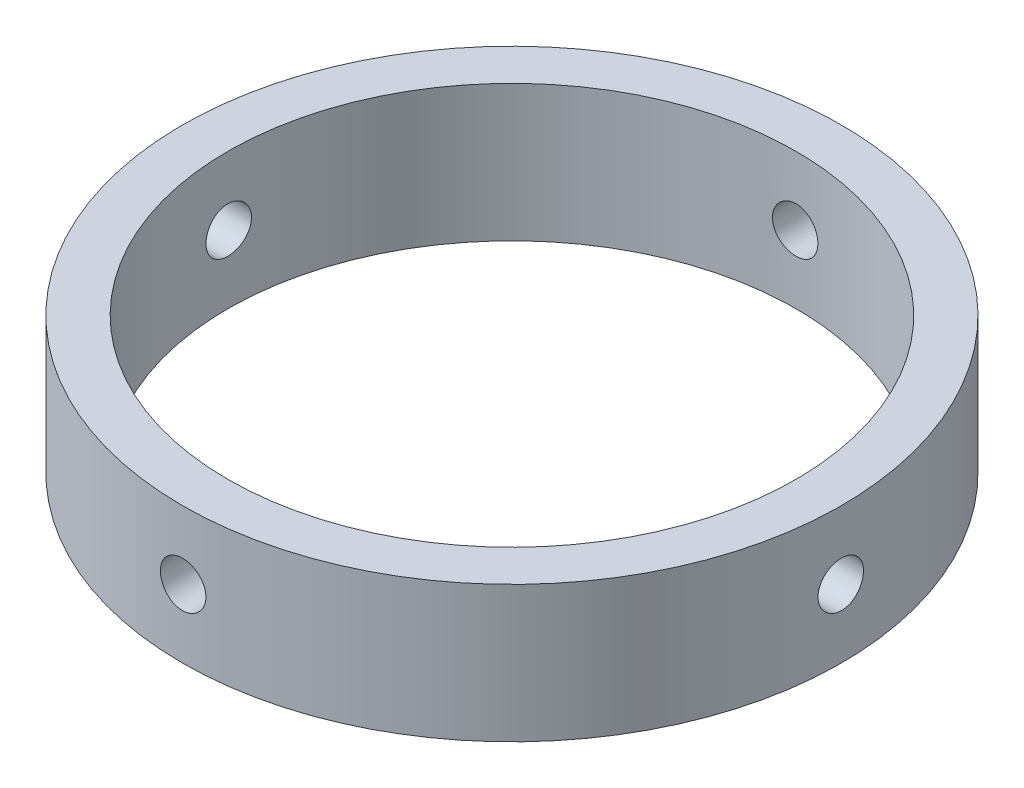
from build123d import *

# Parameters (mm, degrees)
SKETCH1_R               = 46.0375
SKETCH1_R_2             = 39.6875
BOSS_EXTRUDE1_DEPTH     = 19.05
CUT_EXTRUDE4_DEPTH      = 76.2
CUT_EXTRUDE4_DEPTH_BACK = 76.2
SKETCH7_R               = 3.175
CUT_EXTRUDE5_DEPTH      = 76.2
CUT_EXTRUDE5_DEPTH_BACK = 76.2
SKETCH10_R              = 3.175


with BuildPart() as part:
    # Sketch1 → Boss-Extrude1 (new body)
    with BuildSketch(Plane(origin=(0, 0, 0), x_dir=(1, 0, 0), z_dir=(0, 1, 0))):
        Circle(SKETCH1_R)
        Circle(SKETCH1_R_2, mode=Mode.SUBTRACT)
    extrude(amount=BOSS_EXTRUDE1_DEPTH)

    # Sketch7 → Cut-Extrude4 (cut, two sides: drawn at the far end of the back side and taken through both)
    with BuildSketch(Plane.XY.offset(-CUT_EXTRUDE4_DEPTH_BACK)):
        with Locations((0, 9.525)):
            Circle(SKETCH7_R)
    extrude(amount=CUT_EXTRUDE4_DEPTH + CUT_EXTRUDE4_DEPTH_BACK, mode=Mode.SUBTRACT)

    # Sketch10 → Cut-Extrude5 (cut, two sides: drawn at the far end of the back side and taken through both)
    with BuildSketch(Plane(origin=(0, 0, 0), x_dir=(0, 0, -1), z_dir=(1, 0, 0)).offset(-CUT_EXTRUDE5_DEPTH_BACK)):
        with Locations((0, 9.525)):
            Circle(SKETCH10_R)
    extrude(amount=CUT_EXTRUDE5_DEPTH + CUT_EXTRUDE5_DEPTH_BACK, mode=Mode.SUBTRACT)


solid = part.part
